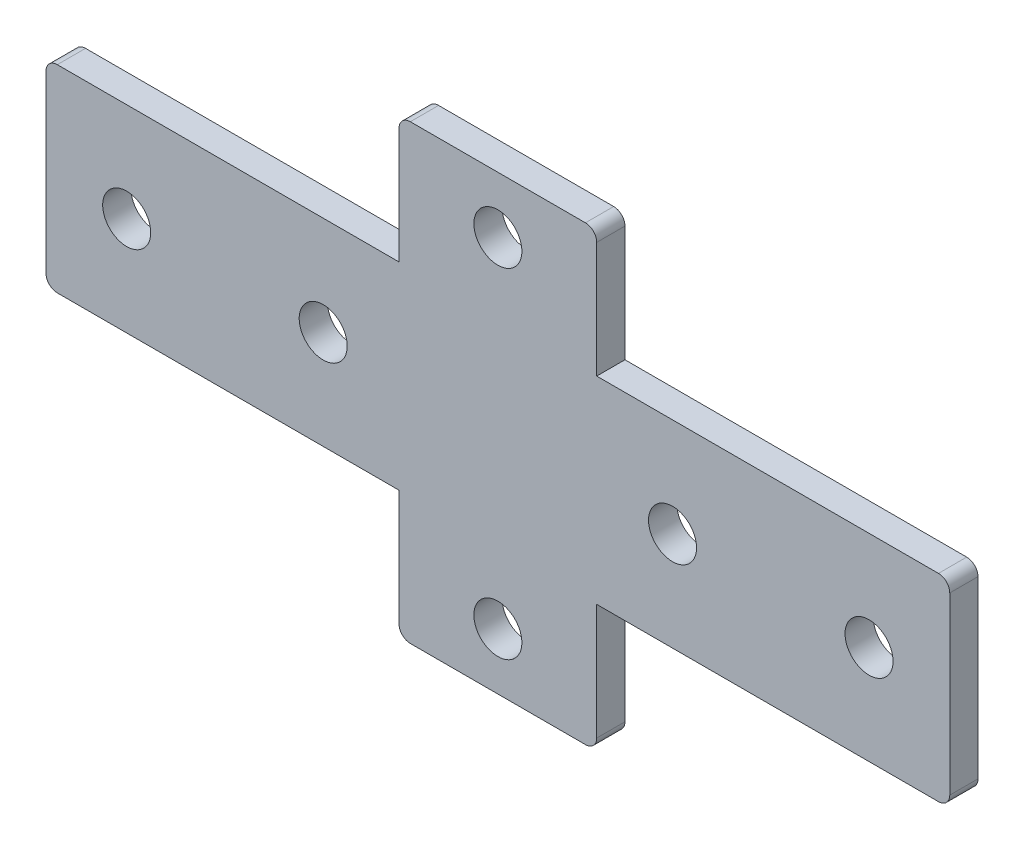
from build123d import *

# Parameters (mm, degrees)
EXTRUDE_1_DEPTH     = 5
FILLET_1_R          = 2
SKETCH_2_R          = 4.25
CUT_EXTRUDE_1_DEPTH = 90.582364336


with BuildPart() as part:
    # 草图1 → 凸台-拉伸1 (new body)
    with BuildSketch(Plane.XY):
        Polygon((17.5, 17.5), (80, 17.5), (80, -17.5), (17.5, -17.5), (17.5, -40), (-17.5, -40), (-17.5, -17.5), (-80, -17.5), (-80, 17.5), (-17.5, 17.5), (-17.5, 40), (17.5, 40), align=None)
    extrude(amount=EXTRUDE_1_DEPTH)

    # 圆角1
    fillet_1_edges = [part.edges().sort_by_distance(p)[0] for p in [
        (80, -17.5, 2.5),
        (17.5, -40, 2.5),
        (-17.5, -40, 2.5),
        (-80, -17.5, 2.5),
        (-80, 17.5, 2.5),
        (-17.5, 40, 2.5),
        (17.5, 40, 2.5),
        (80, 17.5, 2.5),
    ]]
    fillet(fillet_1_edges, radius=FILLET_1_R)

    # 草图2 → 切除-拉伸1 (cut, through all)
    with BuildSketch(Plane.XY.offset(5)):
        with Locations((0, 30)):
            Circle(SKETCH_2_R)
        with Locations((-65.712823547, 0)):
            Circle(SKETCH_2_R)
        with Locations((-30.923378323, 0)):
            Circle(SKETCH_2_R)
    cut_extrude_1 = extrude(amount=-CUT_EXTRUDE_1_DEPTH, mode=Mode.SUBTRACT)

    # 镜向1: 切除-拉伸1 across plane
    add(cut_extrude_1.mirror(Plane.ZX), mode=Mode.SUBTRACT)

    # 镜向2: 切除-拉伸1 across plane
    add(cut_extrude_1.mirror(Plane(origin=(0, 0, 0), x_dir=(0, 0, 1), z_dir=(1, 0, 0))), mode=Mode.SUBTRACT)


solid = part.part
